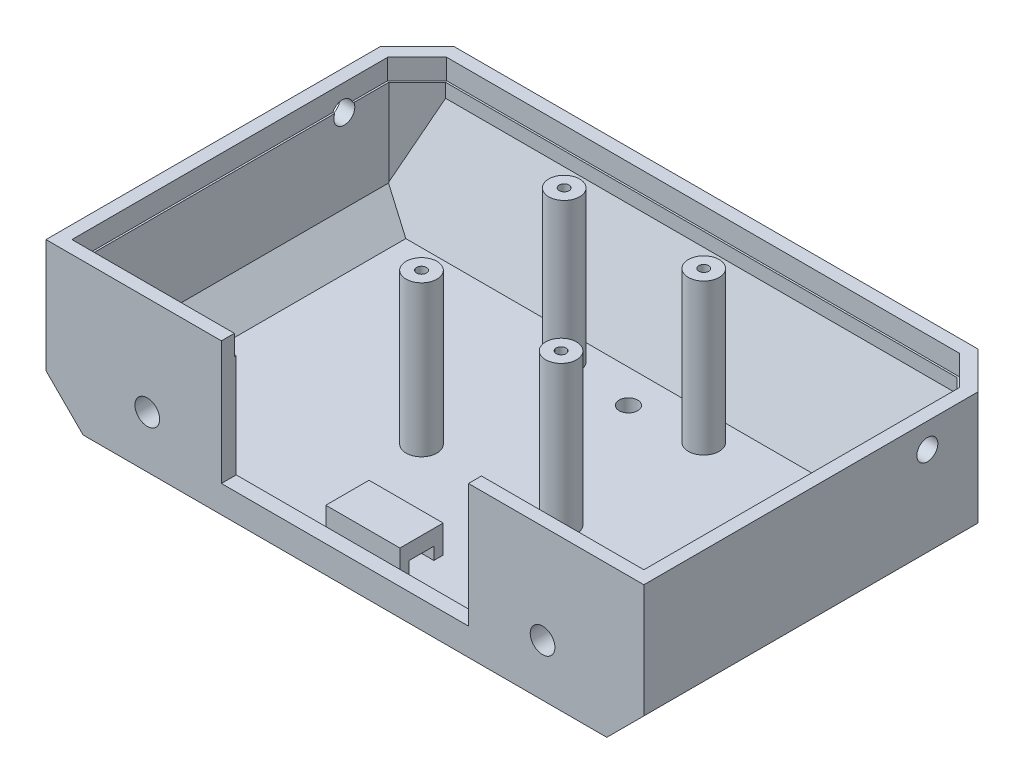
from build123d import *

# Parameters (mm, degrees)
TRAY_BLOCK_DEPTH              = 24.4
LOWER_FRONT_FACET_DEPTH       = 74.975401317
LOWER_FRONT_FACET_DEPTH_BACK  = 74.975401317
LOWER_SIDE_FACET_L_DEPTH      = 74.975401317
LOWER_SIDE_FACET_L_DEPTH_BACK = 74.975401317
LOWER_SIDE_FACET_R_DEPTH      = 74.975401317
LOWER_SIDE_FACET_R_DEPTH_BACK = 74.975401317
SHELL_T                       = -2.4
SEAM_REBATE_DEPTH             = 4.3
SKETCH6_R                     = 2.5
BOARD_PILLARS_DEPTH           = 24.9
SKETCH7_R                     = 0.8
BOARD_PILOTS_DEPTH            = 8.5
SKETCH8_W                     = 40
SKETCH8_H                     = 21
CABLE_WINDOW_DEPTH            = 3.9
SKETCH9_R                     = 4
FLANGE_BOSSES_DEPTH           = 6.2
SKETCH10_R                    = 2
FLANGE_INSERT_HOLES_DEPTH     = 7
SKETCH11_R                    = 1.7
SEAM_SCREW_HOLE_L_DEPTH       = 3.9
SKETCH12_R                    = 1.7
SEAM_SCREW_HOLE_R_DEPTH       = 3.9
SKETCH13_W                    = 12
SKETCH13_H                    = 7
BUNDLE_TIE_ANCHOR_DEPTH       = 5
SKETCH14_W                    = 4
SKETCH14_H                    = 2
BUNDLE_TIE_SLOT_DEPTH         = 14
SKETCH15_R                    = 1.5
DRAIN_HOLE_DEPTH              = 3.9


with BuildPart() as part:
    # Sketch1 → Tray Block (new body)
    with BuildSketch(Plane(origin=(0, -28.4, 0), x_dir=(1, 0, 0), z_dir=(0, 1, 0))):
        Polygon((-48.4, -11.9), (48.4, -11.9), (48.4, 42.2), (42.4, 48.2), (-42.4, 48.2), (-48.4, 42.2), align=None)
    extrude(amount=TRAY_BLOCK_DEPTH)

    # Sketch2 → Lower Front Facet (cut, two sides: drawn at the far end of the back side and taken through both)
    with BuildSketch(Plane(origin=(0, 0, 0), x_dir=(0, 0, -1), z_dir=(1, 0, 0)).offset(-LOWER_FRONT_FACET_DEPTH_BACK)):
        Polygon((49.64, -6.32), (53.2, -6.32), (53.2, -32.08), (39.56, -32.08), align=None)
    extrude(amount=LOWER_FRONT_FACET_DEPTH + LOWER_FRONT_FACET_DEPTH_BACK, mode=Mode.SUBTRACT)

    # Sketch3 → Lower Side Facet L (cut, two sides: drawn at the far end of the back side and taken through both)
    with BuildSketch(Plane.XY.offset(-LOWER_SIDE_FACET_L_DEPTH_BACK)):
        Polygon((-49.4, -21.4), (-49.4, -29.4), (-41.4, -29.4), align=None)
    extrude(amount=LOWER_SIDE_FACET_L_DEPTH + LOWER_SIDE_FACET_L_DEPTH_BACK, mode=Mode.SUBTRACT)

    # Sketch4 → Lower Side Facet R (cut, two sides: drawn at the far end of the back side and taken through both)
    with BuildSketch(Plane.XY.offset(-LOWER_SIDE_FACET_R_DEPTH_BACK)):
        Polygon((49.4, -21.4), (49.4, -29.4), (41.4, -29.4), align=None)
    extrude(amount=LOWER_SIDE_FACET_R_DEPTH + LOWER_SIDE_FACET_R_DEPTH_BACK, mode=Mode.SUBTRACT)

    # Shell
    shell_openings = [part.faces().sort_by_distance(p)[0] for p in [
        (0, -4, -17.975344882),
    ]]
    offset(amount=SHELL_T, openings=shell_openings, kind=Kind.INTERSECTION)

    # Sketch5 → Seam Rebate (cut)
    with BuildSketch(Plane(origin=(0, -7.3, 0), x_dir=(1, 0, 0), z_dir=(0, 1, 0))):
        Polygon((-46.3, -9.8), (46.3, -9.8), (46.3, 41.330151519), (41.530151519, 46.1), (-41.530151519, 46.1), (-46.3, 41.330151519), align=None)
    extrude(amount=SEAM_REBATE_DEPTH, mode=Mode.SUBTRACT)

    # Sketch6 → Board Pillars (add)
    with BuildSketch(Plane(origin=(0, -26.5, 0), x_dir=(1, 0, 0), z_dir=(0, 1, 0))):
        with Locations(Location((-11.3, 11.8, 0), (0, 0, 270))):
            Circle(SKETCH6_R)
        with Locations(Location((-11.3, 34.9, 0), (0, 0, 270))):
            Circle(SKETCH6_R)
        with Locations(Location((11.3, 11.8, 0), (0, 0, 270))):
            Circle(SKETCH6_R)
        with Locations(Location((11.3, 34.9, 0), (0, 0, 270))):
            Circle(SKETCH6_R)
    extrude(amount=BOARD_PILLARS_DEPTH)

    # Sketch7 → Board Pilots (cut)
    with BuildSketch(Plane(origin=(0, -9.6, 0), x_dir=(1, 0, 0), z_dir=(0, 1, 0))):
        with Locations(Location((-11.3, 11.8, 0), (0, 0, 270))):
            Circle(SKETCH7_R)
        with Locations(Location((-11.3, 34.9, 0), (0, 0, 270))):
            Circle(SKETCH7_R)
        with Locations(Location((11.3, 11.8, 0), (0, 0, 270))):
            Circle(SKETCH7_R)
        with Locations(Location((11.3, 34.9, 0), (0, 0, 270))):
            Circle(SKETCH7_R)
    extrude(amount=BOARD_PILOTS_DEPTH, mode=Mode.SUBTRACT)

    # Sketch8 → Cable Window (cut)
    with BuildSketch(Plane.XY.offset(9)):
        with Locations((0, -13.5)):
            Rectangle(SKETCH8_W, SKETCH8_H)
    extrude(amount=CABLE_WINDOW_DEPTH, mode=Mode.SUBTRACT)

    # Sketch9 → Flange Bosses (add)
    with BuildSketch(Plane.XY.offset(3.5)):
        with Locations(Location((-32, -20, 0), (0, 0, 180))):
            Circle(SKETCH9_R)
        with Locations(Location((32, -20, 0), (0, 0, 180))):
            Circle(SKETCH9_R)
    extrude(amount=FLANGE_BOSSES_DEPTH)

    # Sketch10 → Flange Insert Holes (cut)
    with BuildSketch(Plane.XY.offset(5.4)):
        with Locations(Location((-32, -20, 0), (0, 0, 180))):
            Circle(SKETCH10_R)
        with Locations(Location((32, -20, 0), (0, 0, 180))):
            Circle(SKETCH10_R)
    extrude(amount=FLANGE_INSERT_HOLES_DEPTH, mode=Mode.SUBTRACT)

    # Sketch11 → Seam Screw Hole L (cut)
    with BuildSketch(Plane(origin=(-49.4, 0, 0), x_dir=(0, 0, -1), z_dir=(1, 0, 0))):
        with Locations(Location((34, -8, 0), (0, 0, 155.684260829))):
            Circle(SKETCH11_R)
    extrude(amount=SEAM_SCREW_HOLE_L_DEPTH, mode=Mode.SUBTRACT)

    # Sketch12 → Seam Screw Hole R (cut)
    with BuildSketch(Plane(origin=(45.5, 0, 0), x_dir=(0, 0, -1), z_dir=(1, 0, 0))):
        with Locations(Location((34, -8, 0), (0, 0, 155.684260829))):
            Circle(SKETCH12_R)
    extrude(amount=SEAM_SCREW_HOLE_R_DEPTH, mode=Mode.SUBTRACT)

    # Sketch13 → Bundle Tie Anchor (add)
    with BuildSketch(Plane(origin=(0, -26.5, 0), x_dir=(1, 0, 0), z_dir=(0, 1, 0))):
        with Locations((0, -5.5)):
            Rectangle(SKETCH13_W, SKETCH13_H)
    extrude(amount=BUNDLE_TIE_ANCHOR_DEPTH)

    # Sketch14 → Bundle Tie Slot (cut)
    with BuildSketch(Plane(origin=(-7, 0, 0), x_dir=(0, 0, -1), z_dir=(1, 0, 0))):
        with Locations((-5.5, -25)):
            Rectangle(SKETCH14_W, SKETCH14_H)
    extrude(amount=BUNDLE_TIE_SLOT_DEPTH, mode=Mode.SUBTRACT)

    # Sketch15 → Drain Hole (cut)
    with BuildSketch(Plane(origin=(0, -29.4, 0), x_dir=(1, 0, 0), z_dir=(0, 1, 0))):
        with Locations(Location((0, 34, 0), (0, 0, 270))):
            Circle(SKETCH15_R)
    extrude(amount=DRAIN_HOLE_DEPTH, mode=Mode.SUBTRACT)


solid = part.part
